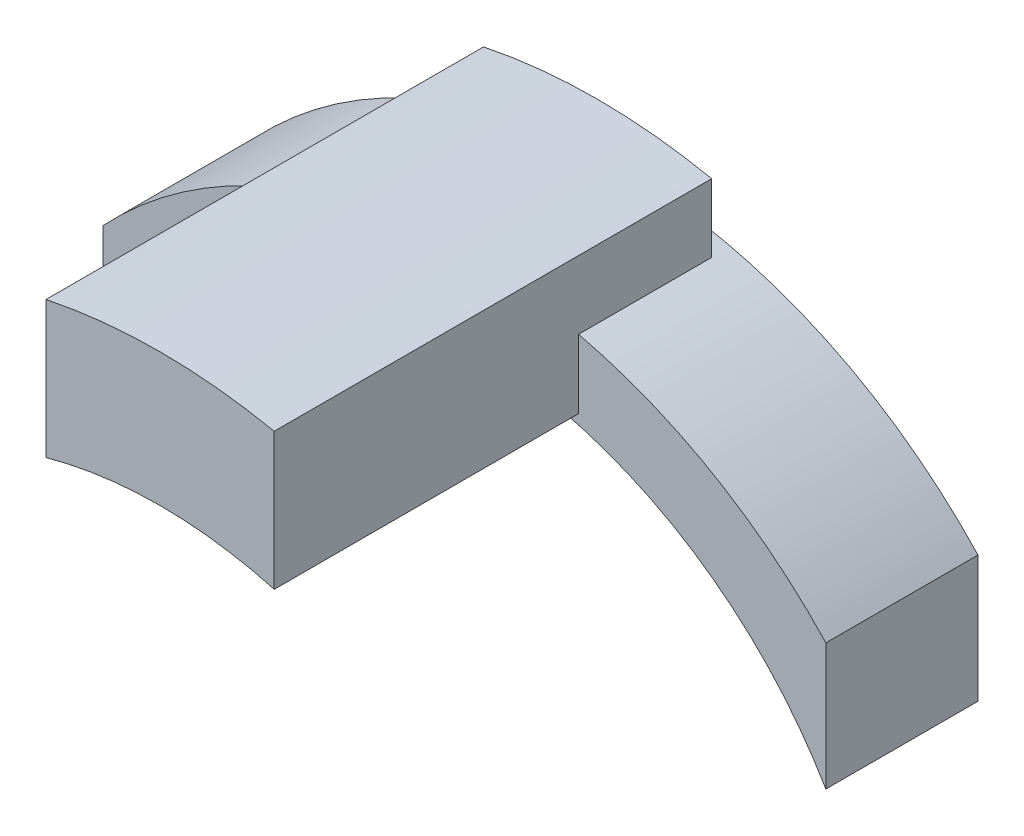
from build123d import *

# Parameters (mm, degrees)
EXTRUDE1_DEPTH      = 4
EXTRUDE2_DEPTH      = 7
EXTRUDE2_DEPTH_BACK = 16


with BuildPart() as part:
    # Sketch1 → Extrude1 (new, symmetric)
    with BuildSketch(Plane.XY):
        with BuildLine():
            Line((-19, 11.090536506), (-19, 17.748239349))
            ThreePointArc((-19, 17.748239349), (0, 26), (19, 17.748239349))
            Line((19, 17.748239349), (19, 11.090536506))
            ThreePointArc((19, 11.090536506), (0, 22), (-19, 11.090536506))
        make_face()
    extrude(amount=EXTRUDE1_DEPTH, both=True)

    # Sketch2 → Extrude2 (add, two sides: drawn at the far end of the back side and taken through both)
    with BuildSketch(Plane(origin=(0, 0, 4), x_dir=(-1, 0, 0), z_dir=(0, 0, -1)).offset(-EXTRUDE2_DEPTH_BACK)):
        with BuildLine():
            Line((6, 21.685248442), (6, 28.883386228))
            ThreePointArc((6, 28.883386228), (0, 29.5), (-6, 28.883386228))
            Line((-6, 28.883386228), (-6, 21.685248442))
            ThreePointArc((-6, 21.685248442), (0, 22.5), (6, 21.685248442))
        make_face()
    extrude(amount=EXTRUDE2_DEPTH + EXTRUDE2_DEPTH_BACK)


solid = part.part
